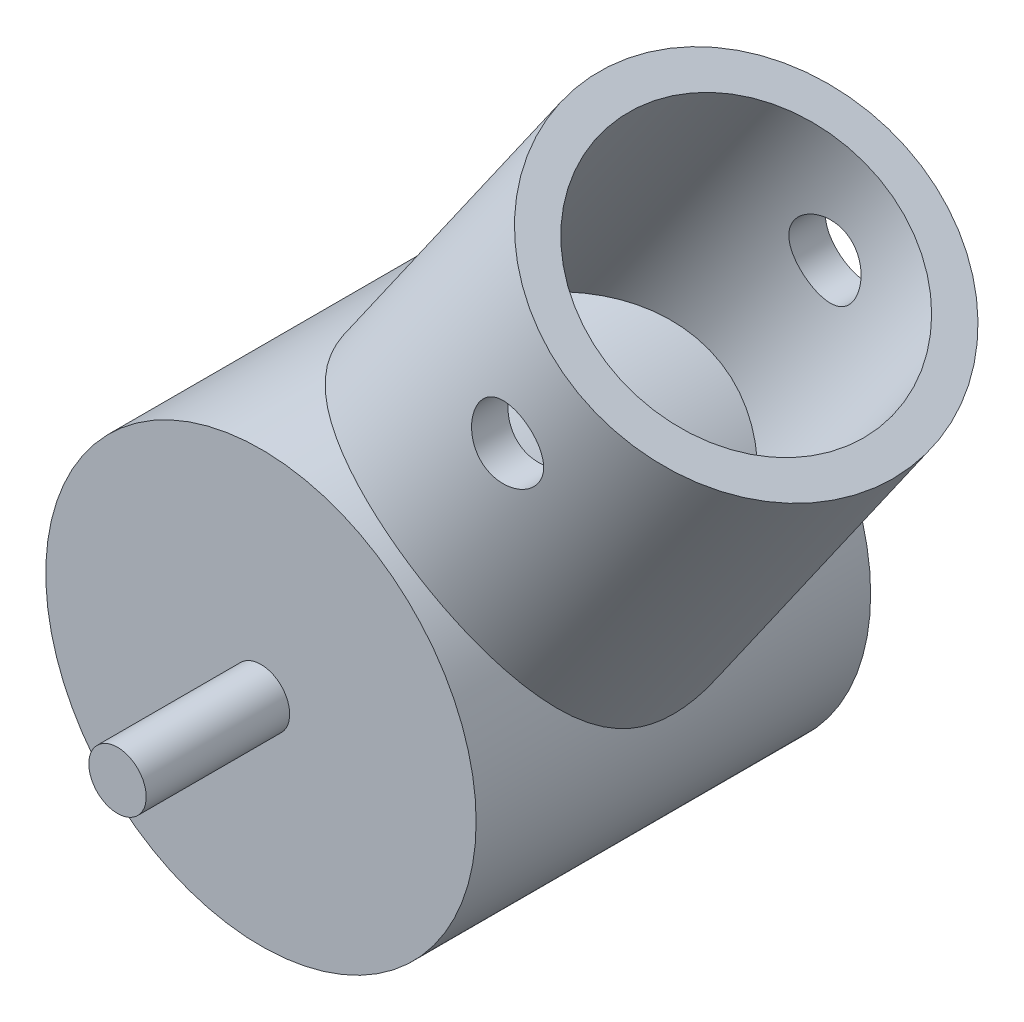
from build123d import *

# Parameters (mm, degrees)
SKETCH1_R           = 30
BOSS_EXTRUDE1_DEPTH = 27.5
SKETCH3_R           = 5
CUT_EXTRUDE1_DEPTH  = 30
SKETCH5_R           = 4
BOSS_EXTRUDE2_DEPTH = 20


with BuildPart() as part:
    # Sketch1 → Boss-Extrude1 (new, symmetric)
    with BuildSketch(Plane.XY):
        Circle(SKETCH1_R)
    extrude(amount=BOSS_EXTRUDE1_DEPTH, both=True)

    # Sketch2 → Revolve2 (revolve)
    with BuildSketch(Plane.XY):
        Polygon((56.53339143, 45.869114373), (60.629151652, 43.001232191), (28.508871216, -2.871282289), (24.413110995, -0.003400107), align=None)
    revolve(axis=Axis((0, 0, 0), (0.5735764363510413, 0.8191520442889952, 0)))

    # Sketch3 → Cut-Extrude1 (cut, symmetric)
    with BuildSketch(Plane.XY):
        with Locations((31.546703999, 45.053362436)):
            Circle(SKETCH3_R)
    extrude(amount=CUT_EXTRUDE1_DEPTH, both=True, mode=Mode.SUBTRACT)

    # Sketch5 → Boss-Extrude2 (add)
    with BuildSketch(Plane.XY.offset(27.5)):
        Circle(SKETCH5_R)
    extrude(amount=BOSS_EXTRUDE2_DEPTH)


solid = part.part
